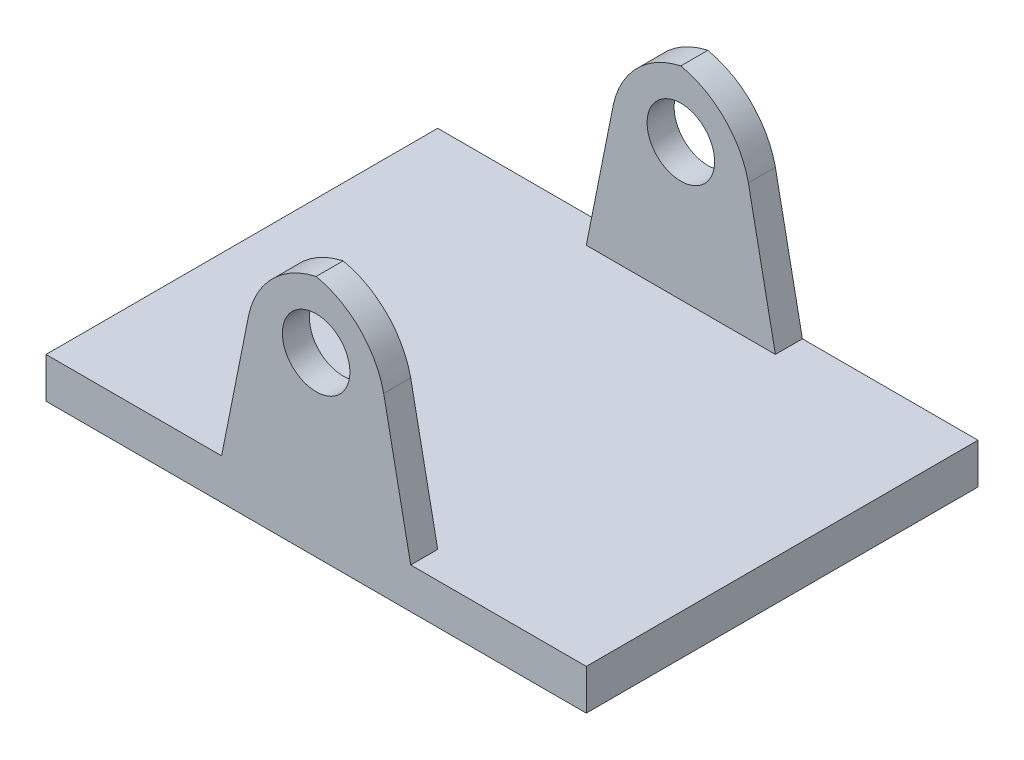
from build123d import *

# Parameters (mm, degrees)
SKETCH1_W           = 400
SKETCH1_H           = 30
BOSS_EXTRUDE1_DEPTH = 290
BOSS_EXTRUDE2_DEPTH = 20
SKETCH4_R           = 25
CUT_EXTRUDE1_DEPTH  = 20
BOSS_EXTRUDE3_START = -20
SKETCH5_R           = 25
BOSS_EXTRUDE3_DEPTH = 20


with BuildPart() as part:
    # Sketch1 → Boss-Extrude1 (new body)
    with BuildSketch(Plane.XY):
        Rectangle(SKETCH1_W, SKETCH1_H)
    extrude(amount=BOSS_EXTRUDE1_DEPTH)

    # Sketch2 → Boss-Extrude2 (add)
    with BuildSketch(Plane.XY.offset(290)):
        with BuildLine():
            Line((0, 165), (0, 115))
            Line((0, 115), (50, 115))
            ThreePointArc((50, 115), (32.360636061, 147.360636061), (0, 165))
        make_face()
        with BuildLine():
            Line((-50, 115), (0, 115))
            Line((0, 115), (0, 165))
            ThreePointArc((0, 165), (-32.360636061, 147.360636061), (-50, 115))
        make_face()
        Polygon((-70, 15), (0, 15), (0, 115), (-50, 115), align=None)
        Polygon((0, 115), (0, 15), (70, 15), (50, 115), align=None)
    extrude(amount=-BOSS_EXTRUDE2_DEPTH)

    # Sketch4 → Cut-Extrude1 (cut)
    with BuildSketch(Plane.XY.offset(290)):
        with Locations((0, 116.092070287)):
            Circle(SKETCH4_R)
    extrude(amount=-CUT_EXTRUDE1_DEPTH, mode=Mode.SUBTRACT)

    # Sketch5 → Boss-Extrude3 (add)
    with BuildSketch(Plane(origin=(0, 0, 0), x_dir=(-1, 0, 0), z_dir=(0, 0, -1)).offset(BOSS_EXTRUDE3_START)):
        with BuildLine():
            Line((-70, 15), (-50, 115))
            ThreePointArc((-50, 115), (-32.360636061, 147.360636061), (0, 165))
            ThreePointArc((0, 165), (32.360636061, 147.360636061), (50, 115))
            Line((50, 115), (70, 15))
            Line((70, 15), (-70, 15))
        make_face()
        with Locations(Location((0, 116.092070287, 0), (0, 0, 180))):
            Circle(SKETCH5_R, mode=Mode.SUBTRACT)
    extrude(amount=BOSS_EXTRUDE3_DEPTH)


solid = part.part
